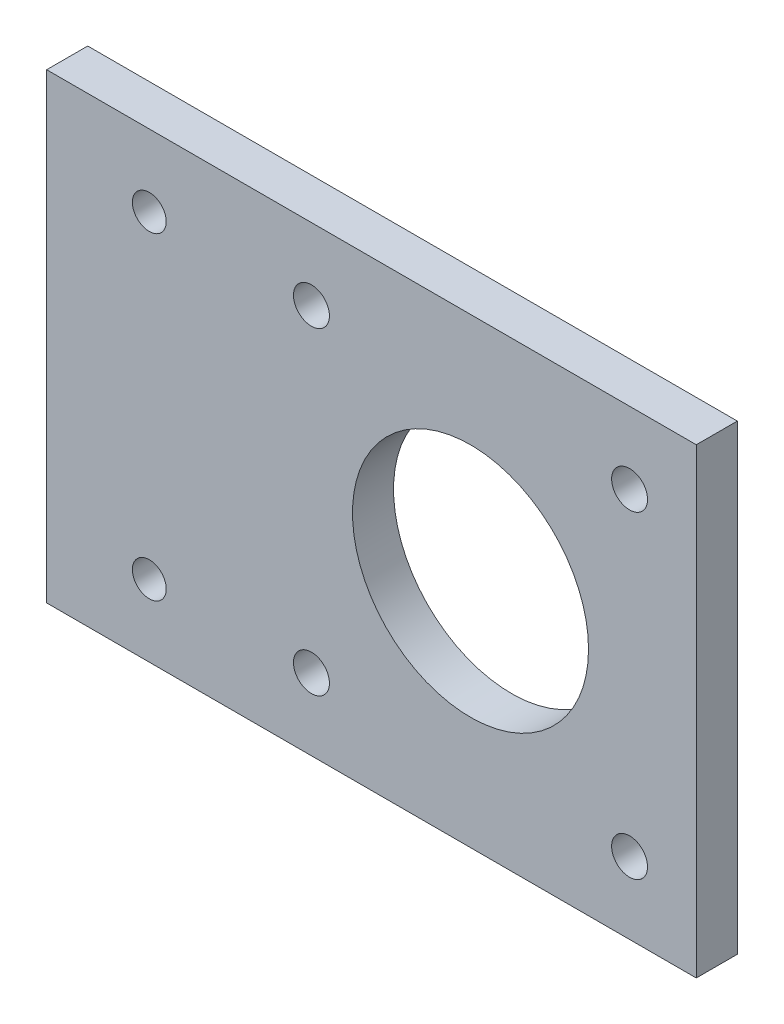
from build123d import *

# Parameters (mm, degrees)
ESBO_O1_W                  = 63.3
ESBO_O1_H                  = 45
ESBO_O1_R                  = 11.5
ESBO_O1_R_2                = 1.75
ESBO_O1_R_3                = 1.65
RESSALTO_EXTRUS_O1_DEPTH   = 25
CORTE_EXTRUS_O1_DEPTH      = 54.262932702
CORTE_EXTRUS_O1_DEPTH_BACK = 54.262932702
ESBO_O2_W                  = 13.3
ESBO_O2_H                  = 21


with BuildPart() as part:
    # Esboço1 → Ressalto-extrusão1 (new body)
    with BuildSketch(Plane.XY):
        with Locations((-9.65, 0)):
            Rectangle(ESBO_O1_W, ESBO_O1_H)
        Circle(ESBO_O1_R, mode=Mode.SUBTRACT)
        with Locations((-15.5, 15.5)):
            Circle(ESBO_O1_R_2, mode=Mode.SUBTRACT)
        with Locations((15.5, 15.5)):
            Circle(ESBO_O1_R_2, mode=Mode.SUBTRACT)
        with Locations((15.5, -15.5)):
            Circle(ESBO_O1_R_2, mode=Mode.SUBTRACT)
        with Locations((-15.5, -15.5)):
            Circle(ESBO_O1_R_2, mode=Mode.SUBTRACT)
        with Locations((-31.3, -15.5)):
            Circle(ESBO_O1_R_3, mode=Mode.SUBTRACT)
        with Locations((-31.3, 15.5)):
            Circle(ESBO_O1_R_3, mode=Mode.SUBTRACT)
    extrude(amount=RESSALTO_EXTRUS_O1_DEPTH)

    # Esboço2 → Corte-extrusão1 (cut, two sides: drawn at the far end of the back side and taken through both)
    with BuildSketch(Plane(origin=(0, 0, 0), x_dir=(1, 0, 0), z_dir=(0, 1, 0)).offset(-CORTE_EXTRUS_O1_DEPTH_BACK)):
        with Locations((-34.65, -14.5)):
            Rectangle(ESBO_O2_W, ESBO_O2_H)
        Polygon((-23, -25), (22, -25), (22, -4), align=None)
        Polygon((-23, -25), (22, -4), (-23, -4), (-28, -4), (-28, -25), align=None)
    extrude(amount=CORTE_EXTRUS_O1_DEPTH + CORTE_EXTRUS_O1_DEPTH_BACK, mode=Mode.SUBTRACT)


solid = part.part
